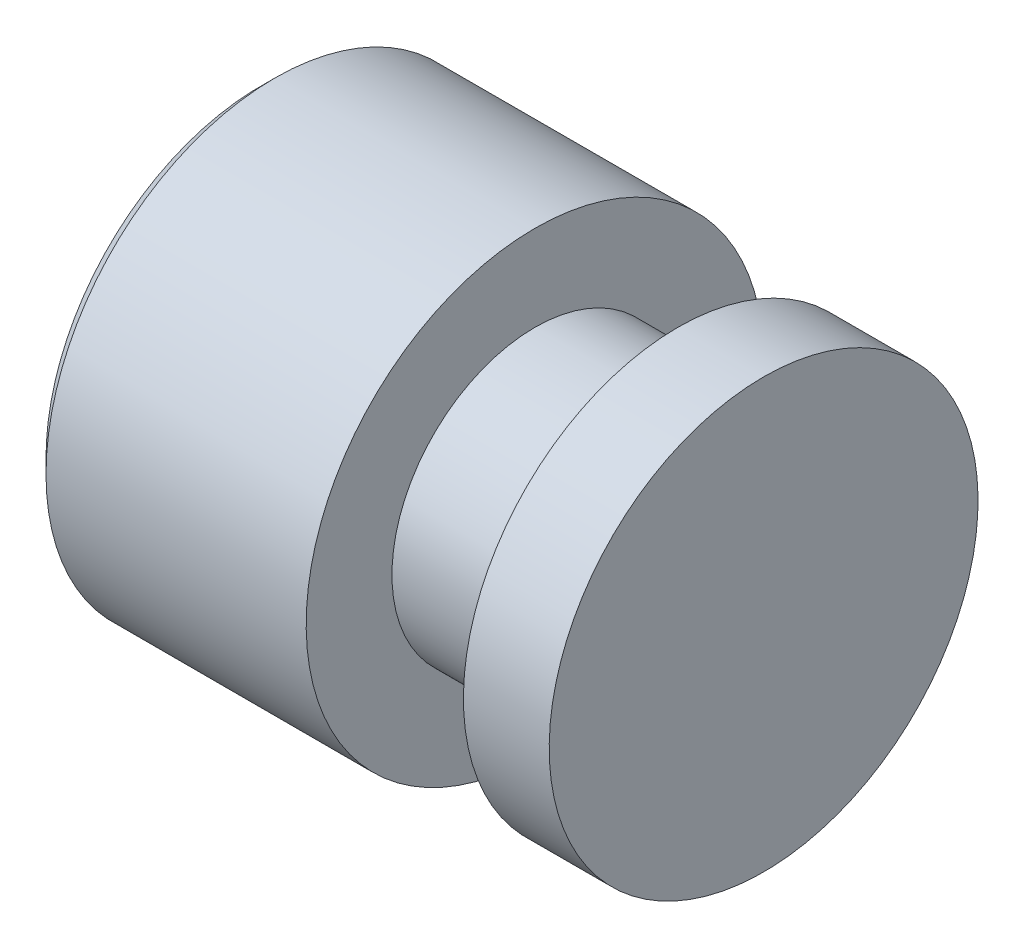
from build123d import *

# Parameters (mm, degrees)
CHAMFER1_SIZE       = 0.5
SKETCH2_R           = 7.5
SKETCH2_R_2         = 5
BOSS_EXTRUDE1_DEPTH = 3


with BuildPart() as part:
    # Sketch1 → Revolve1 (revolve)
    with BuildSketch(Plane.XY):
        Polygon((0, 0), (0, 8), (9.6, 8), (9.6, 5), (17.6, 5), (17.6, 0), align=None)
    revolve(axis=Axis((17.6, 0, 0), (-1, 0, 0)))

    # Chamfer1
    chamfer1_edges = [part.edges().sort_by_distance(p)[0] for p in [
        (0, -8, 0),
    ]]
    chamfer(chamfer1_edges, length=CHAMFER1_SIZE)

    # Sketch2 → Boss-Extrude1 (add)
    with BuildSketch(Plane(origin=(17.6, 0, 0), x_dir=(0, 0, -1), z_dir=(1, 0, 0))):
        with Locations(Location((0, 0, 0), (0, 0, 90))):
            Circle(SKETCH2_R)
        with Locations(Location((0, 0, 0), (0, 0, 90))):
            Circle(SKETCH2_R_2, mode=Mode.SUBTRACT)
    extrude(amount=-BOSS_EXTRUDE1_DEPTH)


solid = part.part
